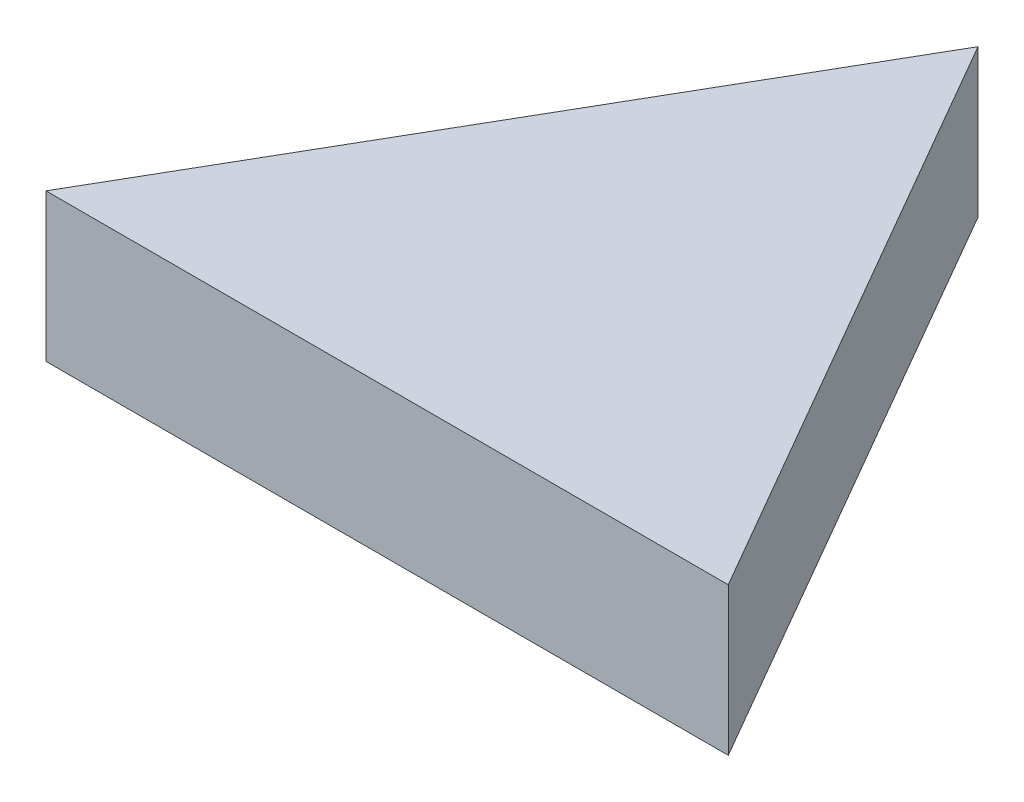
from build123d import *

# Parameters (mm, degrees)
BOSS_EXTRUDE1_DEPTH = 6.35


with BuildPart() as part:
    # Sketch1 → Boss-Extrude1 (new body)
    with BuildSketch(Plane(origin=(0, 0, 0), x_dir=(1, 0, 0), z_dir=(0, 1, 0))):
        Polygon((0, 16.933333333), (-14.664696837, -8.466666667), (14.664696837, -8.466666667), align=None)
    extrude(amount=BOSS_EXTRUDE1_DEPTH)


solid = part.part
